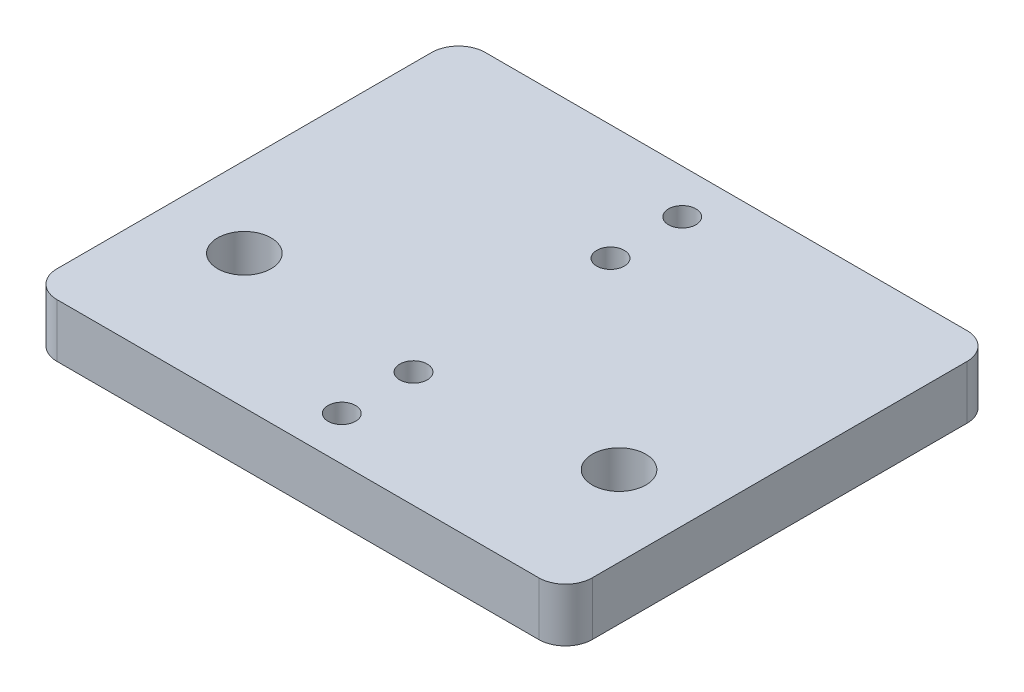
from build123d import *

# Parameters (mm, degrees)
SKETCH1_W           = 127
SKETCH1_H           = 101.6
SKETCH1_R           = 3.2639
SKETCH1_R_2         = 6.35
BOSS_EXTRUDE1_DEPTH = 6.35
FILLET1_R           = 6.35


with BuildPart() as part:
    # Sketch1 → Boss-Extrude1 (new, symmetric)
    with BuildSketch(Plane(origin=(0, 0, 0), x_dir=(1, 0, 0), z_dir=(0, 1, 0))):
        Rectangle(SKETCH1_W, SKETCH1_H)
        with Locations(Location((0, 23.368, 0), (0, 0, 270))):
            Circle(SKETCH1_R, mode=Mode.SUBTRACT)
        with Locations(Location((0, 40.386, 0), (0, 0, 270))):
            Circle(SKETCH1_R, mode=Mode.SUBTRACT)
        with Locations(Location((0, -23.368, 0), (0, 0, 90))):
            Circle(SKETCH1_R, mode=Mode.SUBTRACT)
        with Locations(Location((0, -40.386, 0), (0, 0, 90))):
            Circle(SKETCH1_R, mode=Mode.SUBTRACT)
        with Locations(Location((-44.45, -19.05, 0), (0, 0, 270))):
            Circle(SKETCH1_R_2, mode=Mode.SUBTRACT)
        with Locations(Location((44.45, -19.05, 0), (0, 0, 270))):
            Circle(SKETCH1_R_2, mode=Mode.SUBTRACT)
    extrude(amount=BOSS_EXTRUDE1_DEPTH, both=True)

    # Fillet1
    fillet1_edges = [part.edges().sort_by_distance(p)[0] for p in [
        (63.5, 0, 50.8),
        (-63.5, 0, 50.8),
        (-63.5, 0, -50.8),
        (63.5, 0, -50.8),
    ]]
    fillet(fillet1_edges, radius=FILLET1_R)


solid = part.part
